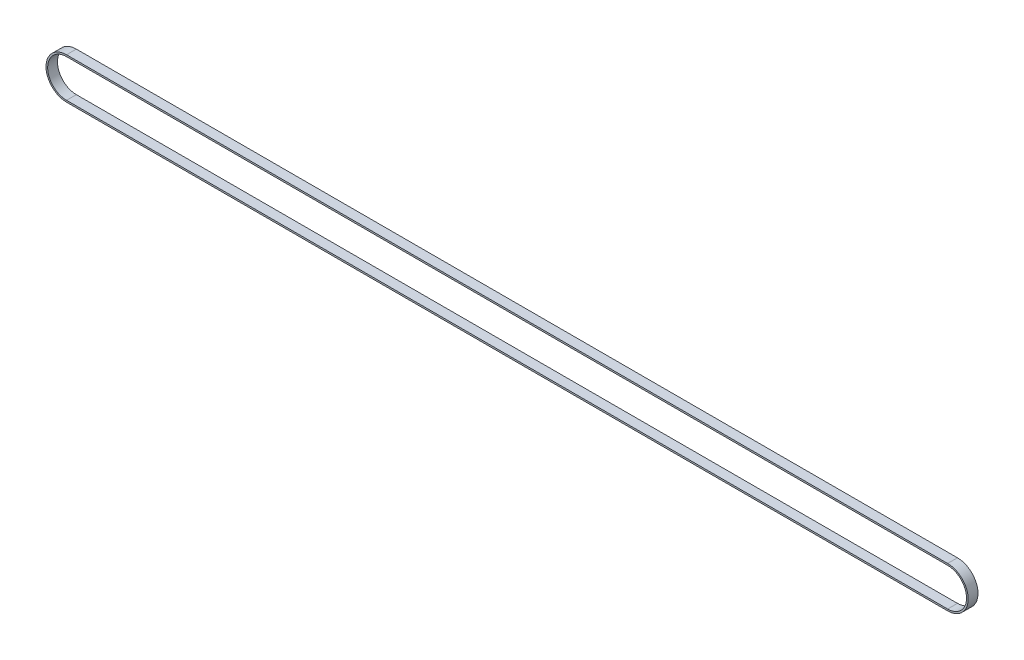
from build123d import *

# Parameters (mm, degrees)
RESSALTO_EXTRUS_O1_DEPTH = 4.15


with BuildPart() as part:
    # Esboço1 → Ressalto-extrusão1 (new body)
    with BuildSketch(Plane.XY):
        with BuildLine():
            Line((-186.5, 8.7), (186.5, 8.7))
            ThreePointArc((186.5, 8.7), (195.2, 0), (186.5, -8.7))
            Line((186.5, -8.7), (-186.5, -8.7))
            ThreePointArc((-186.5, -8.7), (-195.2, 0), (-186.5, 8.7))
        make_face()
        with BuildLine():
            Line((-186.5, 8), (186.5, 8))
            ThreePointArc((186.5, 8), (194.5, 0), (186.5, -8))
            Line((186.5, -8), (-186.5, -8))
            ThreePointArc((-186.5, -8), (-194.5, 0), (-186.5, 8))
        make_face(mode=Mode.SUBTRACT)
    extrude(amount=RESSALTO_EXTRUS_O1_DEPTH)


solid = part.part
